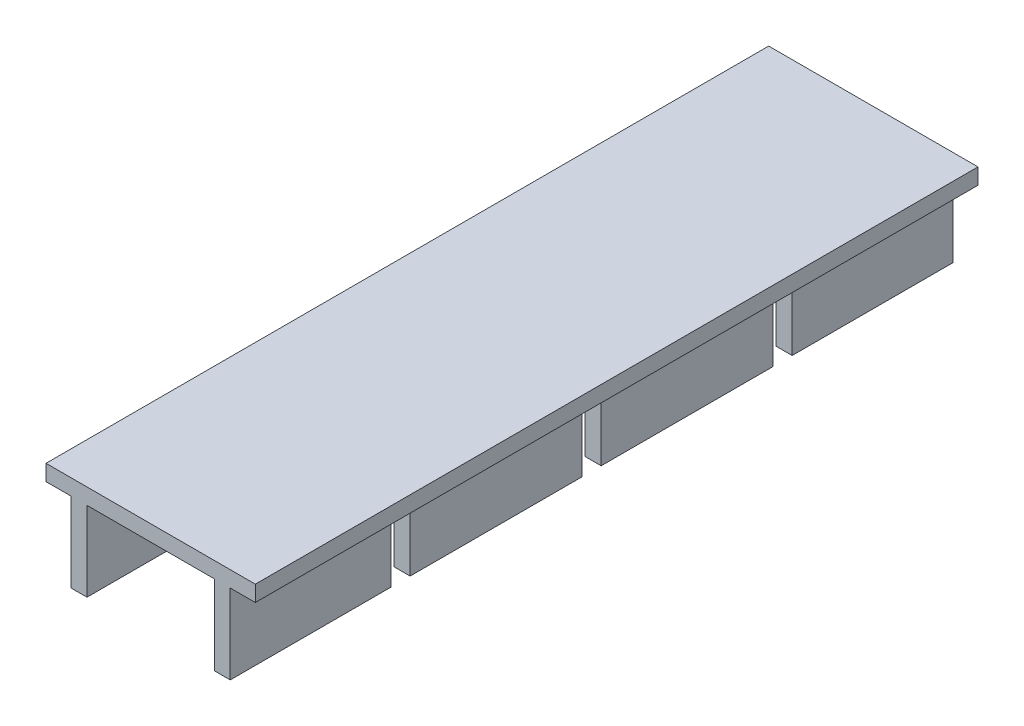
from build123d import *

# Parameters (mm, degrees)
BOSS_EXTRUDE1_DEPTH = 288.29
CUT_EXTRUDE2_REACH  = 301.942
SKETCH4_W           = 7.62
SKETCH4_H           = 23.8125
LPATTERN1_COUNT     = 3
LPATTERN1_PITCH     = 76.2


with BuildPart() as part:
    # Sketch1 → Boss-Extrude1 (new body)
    with BuildSketch(Plane.XY):
        Polygon((57.15, 0), (57.15, 31.75), (6.35, 31.75), (6.35, 0), (0, 0), (0, 31.75), (-10, 31.75), (-10, 38.1), (0, 38.1), (63.5, 38.1), (73.5, 38.1), (73.5, 31.75), (63.5, 31.75), (63.5, 9.525), (63.5, 0), align=None)
    extrude(amount=BOSS_EXTRUDE1_DEPTH)

    # Cut-Extrude2: up to this face of the body (flat: up to its plane)
    cut_extrude2_end = Plane(part.part.faces().sort_by_distance((0, 15.875, 144.145))[0])
    # Sketch4 → Cut-Extrude2 (cut, up to the picked face)
    with BuildSketch(Plane(origin=(63.5, 0, 0), x_dir=(0, 0, -1), z_dir=(1, 0, 0)), mode=Mode.PRIVATE) as cut_extrude2_sk1:
        with Locations((-220.345, 11.90625)):
            Rectangle(SKETCH4_W, SKETCH4_H)
    cut_extrude2_tool1 = split(extrude(cut_extrude2_sk1.sketch, amount=-CUT_EXTRUDE2_REACH, mode=Mode.PRIVATE), bisect_by=cut_extrude2_end, keep=Keep.BOTH, mode=Mode.PRIVATE)
    cut_extrude2 = cut_extrude2_tool1.solids().sort_by(Axis((63.5, 11.90625, 220.345), (-1, 0, 0)))[0]
    add(cut_extrude2, mode=Mode.SUBTRACT)

    # LPattern1: Cut-Extrude2 ×3
    with Locations(*[(0, 0, -i * LPATTERN1_PITCH) for i in range(1, LPATTERN1_COUNT)]):
        add(cut_extrude2, mode=Mode.SUBTRACT)


solid = part.part
